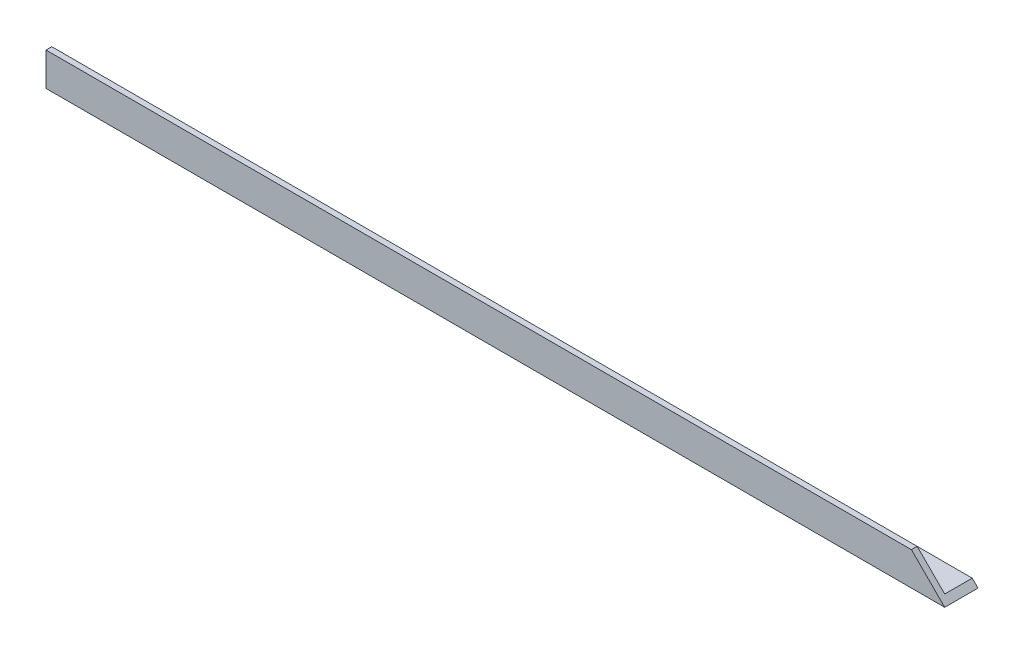
from build123d import *

# Parameters (mm, degrees)
BOSS_EXTRUDE1_DEPTH = 540
CUT_EXTRUDE1_DEPTH  = 541.740233384


with BuildPart() as part:
    # Sketch1 → Boss-Extrude1 (new body)
    with BuildSketch(Plane(origin=(0, 0, 0), x_dir=(0, 0, -1), z_dir=(1, 0, 0))):
        Polygon((0, 0), (20, 0), (20, 3.461178467), (3.461178467, 3.461178467), (3.461178467, 20), (0, 20), align=None)
    extrude(amount=BOSS_EXTRUDE1_DEPTH)

    # Sketch2 → Cut-Extrude1 (cut, through all)
    with BuildSketch(Plane(origin=(0, 0, 0), x_dir=(1, 0, 0), z_dir=(0, 0, -1))):
        Polygon((540, 0), (520, -20), (540, -20), align=None)
    extrude(amount=CUT_EXTRUDE1_DEPTH, mode=Mode.SUBTRACT)


solid = part.part
